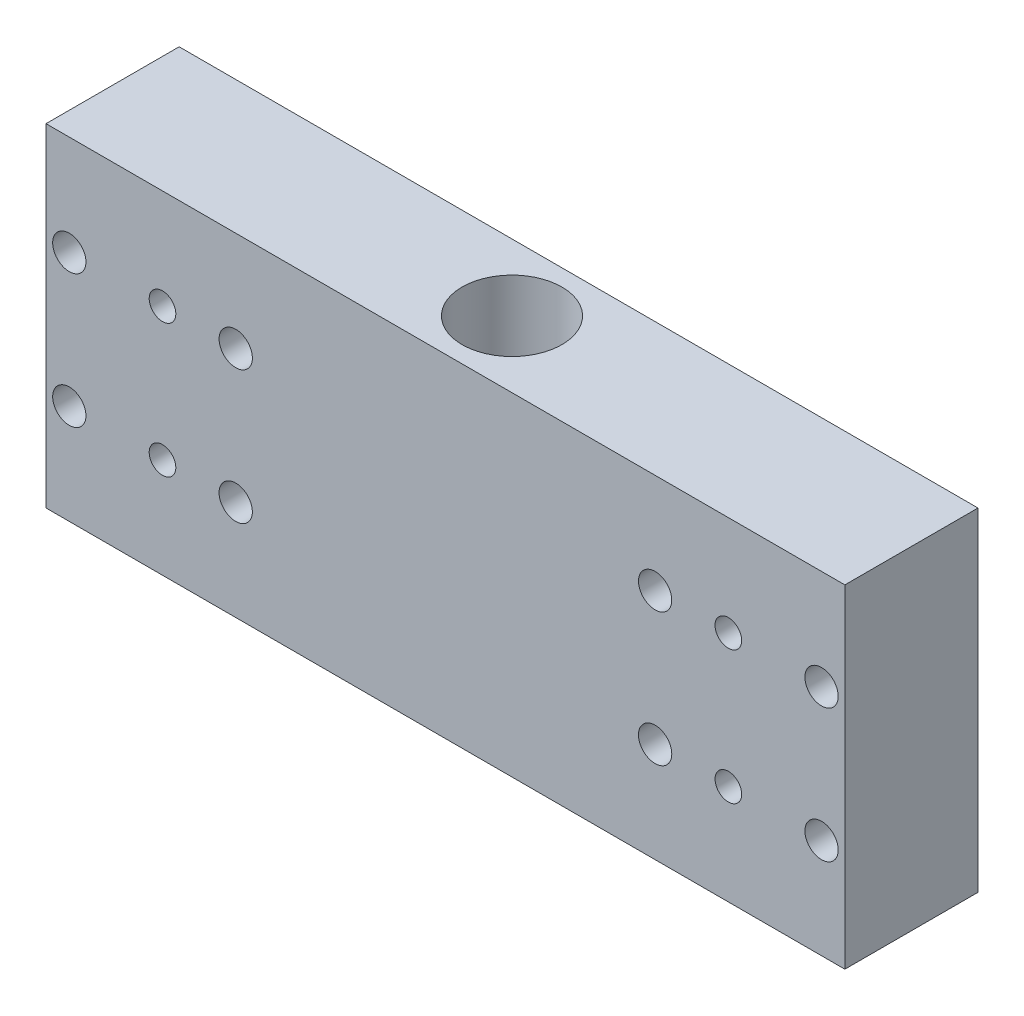
from build123d import *

# Parameters (mm, degrees)
SKETCH1_W               = 120
SKETCH1_H               = 50
BOSS_EXTRUDE1_DEPTH     = 20
CUT_EXTRUDE1_DEPTH      = 69.007352544
CUT_EXTRUDE1_DEPTH_BACK = 69.007352544
SKETCH2_R               = 1.25
SKETCH3_R               = 2.5
CUT_EXTRUDE2_DEPTH      = 5
CUT_EXTRUDE3_REACH      = 82.623
SKETCH4_R               = 7.5
CUT_EXTRUDE4_REACH      = 70.007
SKETCH5_R               = 2


with BuildPart() as part:
    # Sketch1 → Boss-Extrude1 (new body)
    with BuildSketch(Plane.XY):
        Rectangle(SKETCH1_W, SKETCH1_H)
    extrude(amount=BOSS_EXTRUDE1_DEPTH)

    # Sketch2 → Cut-Extrude1 (cut, two sides: drawn at the far end of the back side and taken through both)
    with BuildSketch(Plane.XY.offset(20).offset(-CUT_EXTRUDE1_DEPTH_BACK)):
        with Locations((-56.5, 10)):
            Circle(SKETCH2_R)
        with Locations((-31.5, 10)):
            Circle(SKETCH2_R)
        with Locations((-56.5, -10)):
            Circle(SKETCH2_R)
        with Locations((-31.5, -10)):
            Circle(SKETCH2_R)
        with Locations((56.5, -10)):
            Circle(SKETCH2_R)
        with Locations((31.5, -10)):
            Circle(SKETCH2_R)
        with Locations((31.5, 10)):
            Circle(SKETCH2_R)
        with Locations((56.5, 10)):
            Circle(SKETCH2_R)
    extrude(amount=CUT_EXTRUDE1_DEPTH + CUT_EXTRUDE1_DEPTH_BACK, mode=Mode.SUBTRACT)

    # Sketch3 → Cut-Extrude2 (cut)
    with BuildSketch(Plane.XY.offset(20)):
        with Locations((-56.5, 10)):
            Circle(SKETCH3_R)
        with Locations((-31.5, 10)):
            Circle(SKETCH3_R)
        with Locations(Location((-56.5, -10, 0), (0, 0, 180))):
            Circle(SKETCH3_R)
        with Locations(Location((-31.5, -10, 0), (0, 0, 180))):
            Circle(SKETCH3_R)
        with Locations(Location((56.5, 10, 0), (0, 0, 180))):
            Circle(SKETCH3_R)
        with Locations(Location((31.5, 10, 0), (0, 0, 180))):
            Circle(SKETCH3_R)
        with Locations((31.5, -10)):
            Circle(SKETCH3_R)
        with Locations((56.5, -10)):
            Circle(SKETCH3_R)
    extrude(amount=-CUT_EXTRUDE2_DEPTH, mode=Mode.SUBTRACT)

    # Sketch4 → Cut-Extrude3 (cut, up to next)
    with BuildSketch(Plane(origin=(0, 25, 0), x_dir=(1, 0, 0), z_dir=(0, 1, 0)), mode=Mode.PRIVATE) as cut_extrude3_sk1:
        with Locations(Location((0, -10, 0), (0, 0, 180))):
            Circle(SKETCH4_R)
    cut_extrude3_tool1 = extrude(cut_extrude3_sk1.sketch, amount=-CUT_EXTRUDE3_REACH, mode=Mode.PRIVATE) & part.part
    add(cut_extrude3_tool1.solids().sort_by_distance((0, 25, 10))[0], mode=Mode.SUBTRACT)

    # Sketch5 → Cut-Extrude4 (cut, up to next)
    with BuildSketch(Plane.XY.offset(20), mode=Mode.PRIVATE) as cut_extrude4_sk1:
        with Locations((42.5, 10)):
            Circle(SKETCH5_R)
    cut_extrude4_tool1 = extrude(cut_extrude4_sk1.sketch, amount=-CUT_EXTRUDE4_REACH, mode=Mode.PRIVATE) & part.part
    # Sketch5 → Cut-Extrude4 (cut, up to next)
    with BuildSketch(Plane.XY.offset(20), mode=Mode.PRIVATE) as cut_extrude4_sk2:
        with Locations((42.5, -10)):
            Circle(SKETCH5_R)
    cut_extrude4_tool2 = extrude(cut_extrude4_sk2.sketch, amount=-CUT_EXTRUDE4_REACH, mode=Mode.PRIVATE) & part.part
    # Sketch5 → Cut-Extrude4 (cut, up to next)
    with BuildSketch(Plane.XY.offset(20), mode=Mode.PRIVATE) as cut_extrude4_sk3:
        with Locations((-42.5, -10)):
            Circle(SKETCH5_R)
    cut_extrude4_tool3 = extrude(cut_extrude4_sk3.sketch, amount=-CUT_EXTRUDE4_REACH, mode=Mode.PRIVATE) & part.part
    # Sketch5 → Cut-Extrude4 (cut, up to next)
    with BuildSketch(Plane.XY.offset(20), mode=Mode.PRIVATE) as cut_extrude4_sk4:
        with Locations((-42.5, 10)):
            Circle(SKETCH5_R)
    cut_extrude4_tool4 = extrude(cut_extrude4_sk4.sketch, amount=-CUT_EXTRUDE4_REACH, mode=Mode.PRIVATE) & part.part
    add(cut_extrude4_tool1.solids().sort_by_distance((42.5, 10, 20))[0], mode=Mode.SUBTRACT)
    add(cut_extrude4_tool2.solids().sort_by_distance((42.5, -10, 20))[0], mode=Mode.SUBTRACT)
    add(cut_extrude4_tool3.solids().sort_by_distance((-42.5, -10, 20))[0], mode=Mode.SUBTRACT)
    add(cut_extrude4_tool4.solids().sort_by_distance((-42.5, 10, 20))[0], mode=Mode.SUBTRACT)


solid = part.part
